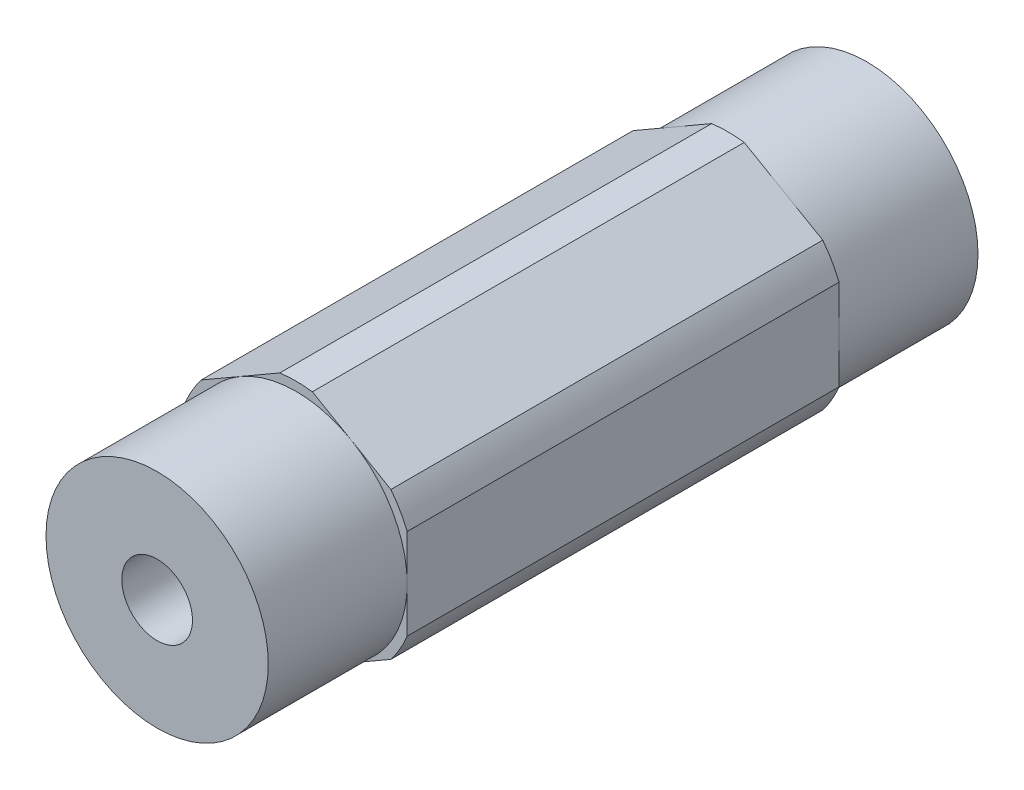
from build123d import *

# Parameters (mm, degrees)
BOSS_EXTRUDE1_DEPTH                  = 12.337299938
SKETCH2_R                            = 6.35
BOSS_EXTRUDE2_DEPTH                  = 7.9375
F_10_32_TAPPED_HOLE1_D               = 4.0386
F_10_32_TAPPED_HOLE1_DEPTH           = 15.07744
F_10_32_TAPPED_HOLE1_TIP             = 1.213317848
F_10_32_TAPPED_HOLE1_ON_FACE_2_D     = 4.0386
F_10_32_TAPPED_HOLE1_ON_FACE_2_DEPTH = 15.07744
F_10_32_TAPPED_HOLE1_ON_FACE_2_TIP   = 1.213317848


with BuildPart() as part:
    # Sketch1 → Boss-Extrude1 (new, symmetric)
    with BuildSketch(Plane.XY):
        with BuildLine():
            ThreePointArc((6.35, 2.590301913), (5.939202219, 3.429), (5.41826726, 4.204110358))
            Line((5.41826726, 4.204110358), (0.93173274, 6.79441227))
            ThreePointArc((0.93173274, 6.79441227), (0, 6.858), (-0.93173274, 6.79441227))
            Line((-0.93173274, 6.79441227), (-5.41826726, 4.204110358))
            ThreePointArc((-5.41826726, 4.204110358), (-5.939202219, 3.429), (-6.35, 2.590301913))
            Line((-6.35, 2.590301913), (-6.35, -2.590301913))
            ThreePointArc((-6.35, -2.590301913), (-5.939202219, -3.429), (-5.41826726, -4.204110358))
            Line((-5.41826726, -4.204110358), (-0.93173274, -6.79441227))
            ThreePointArc((-0.93173274, -6.79441227), (0, -6.858), (0.93173274, -6.79441227))
            Line((0.93173274, -6.79441227), (5.41826726, -4.204110358))
            ThreePointArc((5.41826726, -4.204110358), (5.939202219, -3.429), (6.35, -2.590301913))
            Line((6.35, -2.590301913), (6.35, 2.590301913))
        make_face()
    extrude(amount=BOSS_EXTRUDE1_DEPTH, both=True)

    # Sketch2 → Boss-Extrude2 (add)
    with BuildSketch(Plane.XY.offset(12.337299938)):
        Circle(SKETCH2_R)
    boss_extrude2 = extrude(amount=BOSS_EXTRUDE2_DEPTH)

    # Mirror1: Boss-Extrude2 across plane
    add(boss_extrude2.mirror(Plane.XY))

    # #10-32 Tapped Hole1
    with Locations(Plane.XY.offset(20.274799938)):
        with Locations((0, 0)):
            Hole(F_10_32_TAPPED_HOLE1_D / 2, depth=F_10_32_TAPPED_HOLE1_DEPTH)
            with Locations((0, 0, -(F_10_32_TAPPED_HOLE1_DEPTH + F_10_32_TAPPED_HOLE1_TIP / 2))):  # 118° drill point
                Cone(0, F_10_32_TAPPED_HOLE1_D / 2, F_10_32_TAPPED_HOLE1_TIP, mode=Mode.SUBTRACT)

    # #10-32 Tapped Hole1 on face 2
    with Locations(Plane(origin=(0, 0, -20.274799938), x_dir=(-1, 0, 0), z_dir=(0, 0, -1))):
        with Locations((0, 0)):
            Hole(F_10_32_TAPPED_HOLE1_ON_FACE_2_D / 2, depth=F_10_32_TAPPED_HOLE1_ON_FACE_2_DEPTH)
            with Locations((0, 0, -(F_10_32_TAPPED_HOLE1_ON_FACE_2_DEPTH + F_10_32_TAPPED_HOLE1_ON_FACE_2_TIP / 2))):  # 118° drill point
                Cone(0, F_10_32_TAPPED_HOLE1_ON_FACE_2_D / 2, F_10_32_TAPPED_HOLE1_ON_FACE_2_TIP, mode=Mode.SUBTRACT)


solid = part.part
